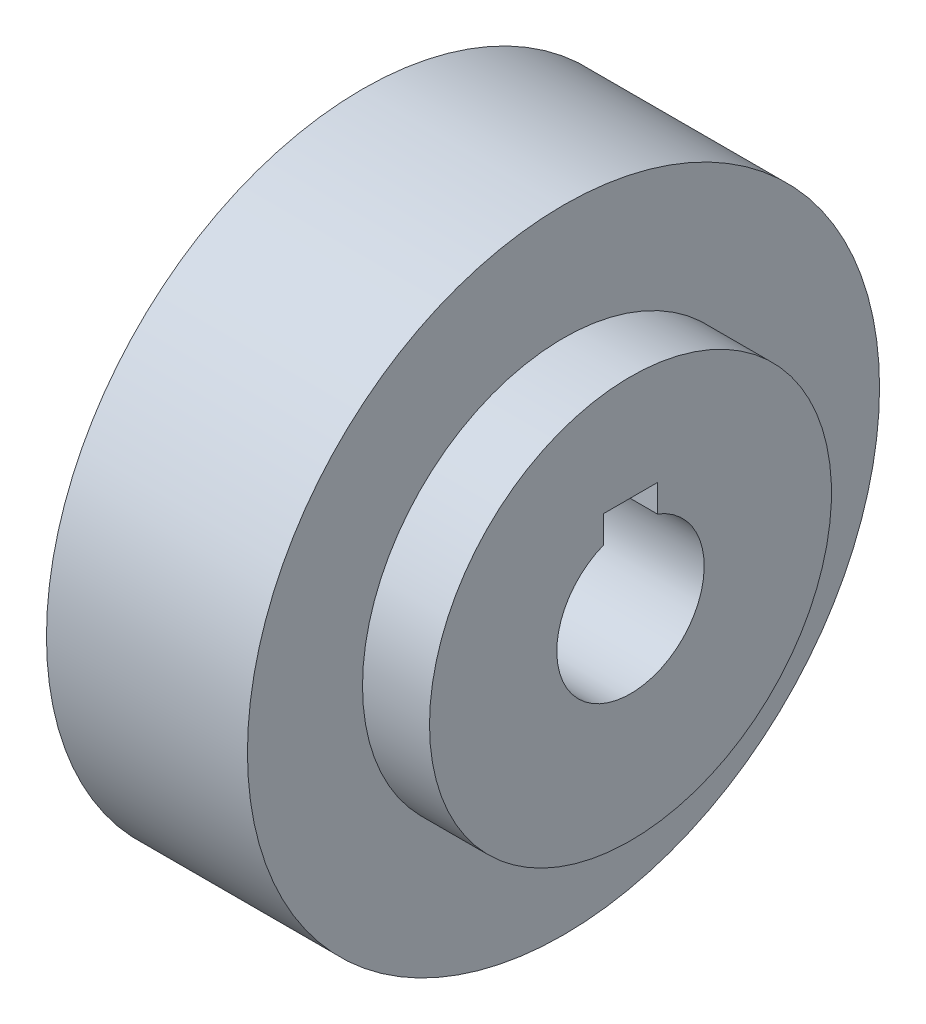
from build123d import *

# Parameters (mm, degrees)
SKETCH2_W          = 8
SKETCH2_H          = 6.6
CUT_EXTRUDE1_DEPTH = 78.787924834


with BuildPart() as part:
    # Sketch1 → Revolve1 (revolve)
    with BuildSketch(Plane.XY, mode=Mode.PRIVATE) as revolve1_sk:
        Polygon((0, 11), (0, 47.175), (30, 47.175), (30, 30), (40, 30), (40, 11), align=None)
    revolve(revolve1_sk.sketch.rotate(Axis((0, 0, 0), (1, 0, 0)), 90), axis=Axis((0, 0, 0), (1, 0, 0)))

    # Sketch2 → Cut-Extrude1 (cut, through all)
    with BuildSketch(Plane.ZY):
        with Locations((0, 11)):
            Rectangle(SKETCH2_W, SKETCH2_H)
    extrude(amount=-CUT_EXTRUDE1_DEPTH, mode=Mode.SUBTRACT)


solid = part.part
